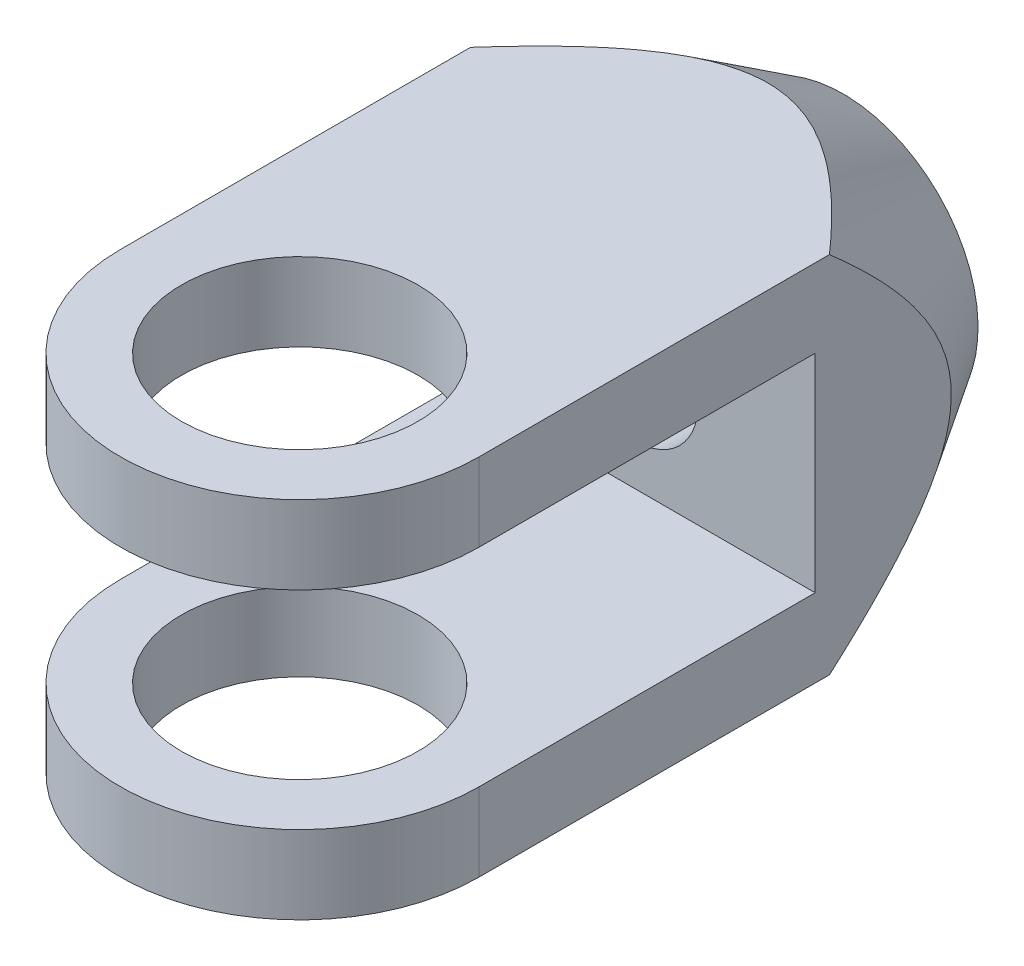
from build123d import *

# Parameters (mm, degrees)
SKETCH1_R           = 7.239
BOSS_EXTRUDE1_DEPTH = 22.2758
SKETCH2_W           = 31.5468
SKETCH2_H           = 12.7
CUT_EXTRUDE1_DEPTH  = 12.7
CUT_EXTRUDE2_REACH  = 52.741
SKETCH7_R           = 3.81


with BuildPart() as part:
    # Sketch1 → Boss-Extrude1 (new body)
    with BuildSketch(Plane(origin=(0, 0, 0), x_dir=(1, 0, 0), z_dir=(0, 1, 0))):
        with BuildLine():
            Line((-10.9855, 0), (-10.9855, 33.2613))
            Line((-10.9855, 33.2613), (10.9855, 33.2613))
            Line((10.9855, 33.2613), (10.9855, 0))
            ThreePointArc((10.9855, 0), (0, -10.9855), (-10.9855, 0))
        make_face()
        with Locations(Location((0, 0, 0), (0, 0, 270))):
            Circle(SKETCH1_R, mode=Mode.SUBTRACT)
    extrude(amount=BOSS_EXTRUDE1_DEPTH)

    # Sketch2 → Cut-Extrude1 (cut, symmetric)
    with BuildSketch(Plane(origin=(0, 0, 0), x_dir=(0, 0, -1), z_dir=(1, 0, 0))):
        with Locations((4.7879, 11.1379)):
            Rectangle(SKETCH2_W, SKETCH2_H)
    extrude(amount=CUT_EXTRUDE1_DEPTH, both=True, mode=Mode.SUBTRACT)

    # Sketch5 → Cut-Revolve1 (revolve, cut)
    with BuildSketch(Plane(origin=(5.568421495, 5.492228727, 0), x_dir=(0, 0, 1), z_dir=(-0.7119608885898049, -0.7022191204449046, 0)), mode=Mode.PRIVATE) as cut_revolve1_sk:
        Polygon((-21.436464447, 23.57372651), (-33.2613, 16.184749181), (-33.2613, 23.57372651), align=None)
    revolve(cut_revolve1_sk.sketch.rotate(Axis((0, 11.1379, -33.2613), (0, 0, 1)), 270.789356568), axis=Axis((0, 11.1379, -33.2613), (0, 0, 1)), mode=Mode.SUBTRACT)

    # Sketch7 → Cut-Extrude2 (cut, up to next)
    with BuildSketch(Plane(origin=(0, 0, -33.2613), x_dir=(-1, 0, 0), z_dir=(0, 0, -1)), mode=Mode.PRIVATE) as cut_extrude2_sk1:
        with Locations((0, 11.1379)):
            Circle(SKETCH7_R)
    cut_extrude2_tool1 = extrude(cut_extrude2_sk1.sketch, amount=-CUT_EXTRUDE2_REACH, mode=Mode.PRIVATE) & part.part
    add(cut_extrude2_tool1.solids().sort_by_distance((0, 11.1379, -33.2613))[0], mode=Mode.SUBTRACT)


solid = part.part
